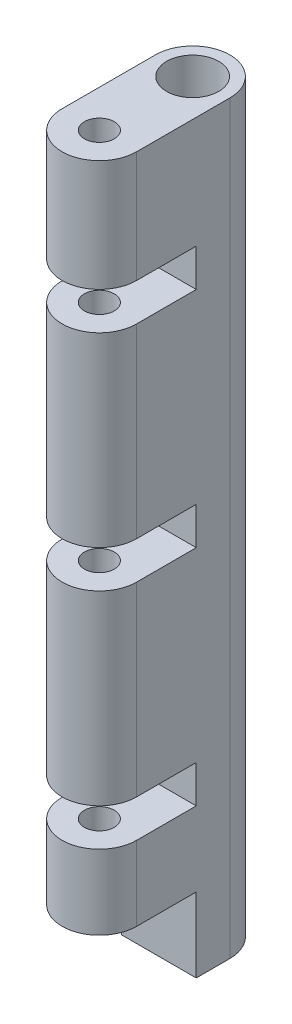
from build123d import *

# Parameters (mm, degrees)
SKETCH2_R           = 6.35
SKETCH2_R_2         = 4.445
BOSS_EXTRUDE1_DEPTH = 127
BOSS_EXTRUDE2_START = -127
SKETCH3_R           = 2.54
BOSS_EXTRUDE2_DEPTH = 127
SKETCH4_W           = 31.75
SKETCH4_H           = 6.4008
SKETCH4_H_2         = 12.7
CUT_EXTRUDE1_DEPTH  = 127


with BuildPart() as part:
    # Sketch2 → Boss-Extrude1 (new body)
    with BuildSketch(Plane(origin=(0, 0, 0), x_dir=(1, 0, 0), z_dir=(0, 1, 0))):
        with Locations(Location((0, 0, 0), (0, 0, 270))):
            Circle(SKETCH2_R)
        with Locations(Location((0, 0, 0), (0, 0, 270))):
            Circle(SKETCH2_R_2, mode=Mode.SUBTRACT)
    extrude(amount=BOSS_EXTRUDE1_DEPTH)

    # Sketch3 → Boss-Extrude2 (add)
    with BuildSketch(Plane(origin=(0, 127, 0), x_dir=(1, 0, 0), z_dir=(0, 1, 0)).offset(BOSS_EXTRUDE2_START)):
        with BuildLine():
            Line((-6.35, 0), (-6.35, -15.898089304))
            ThreePointArc((-6.35, -15.898089304), (0, -22.248089304), (6.35, -15.898089304))
            Line((6.35, -15.898089304), (6.35, 0))
            ThreePointArc((6.35, 0), (0, -6.35), (-6.35, 0))
        make_face()
        with Locations(Location((0, -15.898089304, 0), (0, 0, 270))):
            Circle(SKETCH3_R, mode=Mode.SUBTRACT)
    extrude(amount=BOSS_EXTRUDE2_DEPTH)

    # Sketch4 → Cut-Extrude1 (cut)
    with BuildSketch(Plane(origin=(6.35, 0, 0), x_dir=(0, 0, -1), z_dir=(1, 0, 0))):
        with Locations((-21.613089304, 28.6004)):
            Rectangle(SKETCH4_W, SKETCH4_H)
        with Locations((-21.613089304, 66.7004)):
            Rectangle(SKETCH4_W, SKETCH4_H)
        with Locations((-21.613089304, 104.8004)):
            Rectangle(SKETCH4_W, SKETCH4_H)
        with Locations((-21.613089304, 6.35)):
            Rectangle(SKETCH4_W, SKETCH4_H_2)
    extrude(amount=-CUT_EXTRUDE1_DEPTH, mode=Mode.SUBTRACT)


solid = part.part
